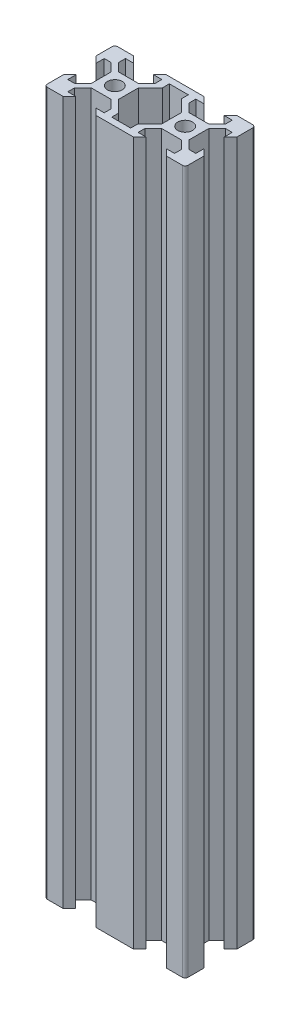
from build123d import *

# Parameters (mm, degrees)
SKETCH3_R               = 2.1
SALIENTE_EXTRUIR1_DEPTH = 200


with BuildPart() as part:
    # Sketch3 → Saliente-Extruir1 (new body)
    with BuildSketch(Plane(origin=(0, 0, 0), x_dir=(1, 0, 0), z_dir=(0, 1, 0))):
        with BuildLine():
            Line((-19.2, -10), (-14.728647189, -10))
            Line((-14.728647189, -10), (-12.928647189, -8.2))
            Line((-12.928647189, -8.2), (-15.179339828, -8.2))
            Line((-15.179339828, -8.2), (-15.179339828, -6.24))
            Line((-15.179339828, -6.24), (-12.84, -3.900660172))
            Line((-12.84, -3.900660172), (-7.16, -3.900660172))
            Line((-7.16, -3.900660172), (-4.820660172, -6.24))
            Line((-4.820660172, -6.24), (-4.820660172, -8.2))
            Line((-4.820660172, -8.2), (-7.104380066, -8.2))
            Line((-7.104380066, -8.2), (-5.304380066, -10))
            Line((-5.304380066, -10), (0, -10))
            Line((0, -10), (5.304380066, -10))
            Line((5.304380066, -10), (7.104380066, -8.2))
            Line((7.104380066, -8.2), (4.820660172, -8.2))
            Line((4.820660172, -8.2), (4.820660172, -6.24))
            Line((4.820660172, -6.24), (7.16, -3.900660172))
            Line((7.16, -3.900660172), (12.84, -3.900660172))
            Line((12.84, -3.900660172), (15.179339828, -6.24))
            Line((15.179339828, -6.24), (15.179339828, -8.2))
            Line((15.179339828, -8.2), (12.928647189, -8.2))
            Line((12.928647189, -8.2), (14.728647189, -10))
            Line((14.728647189, -10), (19.2, -10))
            ThreePointArc((19.2, -10), (19.765685425, -9.765685425), (20, -9.2))
            Line((20, -9.2), (20, -4.619288759))
            Line((20, -4.619288759), (18.2, -2.819288759))
            Line((18.2, -2.819288759), (18.2, -5.179339828))
            Line((18.2, -5.179339828), (16.24, -5.179339828))
            Line((16.24, -5.179339828), (13.900660172, -2.84))
            Line((13.900660172, -2.84), (13.900660172, 2.84))
            Line((13.900660172, 2.84), (16.24, 5.179339828))
            Line((16.24, 5.179339828), (18.2, 5.179339828))
            Line((18.2, 5.179339828), (18.2, 2.895619934))
            Line((18.2, 2.895619934), (20, 4.695619934))
            Line((20, 4.695619934), (20, 9.2))
            ThreePointArc((20, 9.2), (19.765685425, 9.765685425), (19.2, 10))
            Line((19.2, 10), (14.652316014, 10))
            Line((14.652316014, 10), (12.852316014, 8.2))
            Line((12.852316014, 8.2), (15.179339828, 8.2))
            Line((15.179339828, 8.2), (15.179339828, 6.24))
            Line((15.179339828, 6.24), (12.84, 3.900660172))
            Line((12.84, 3.900660172), (7.16, 3.900660172))
            Line((7.16, 3.900660172), (4.820660172, 6.24))
            Line((4.820660172, 6.24), (4.820660172, 8.2))
            Line((4.820660172, 8.2), (7.180711241, 8.2))
            Line((7.180711241, 8.2), (5.380711241, 10))
            Line((5.380711241, 10), (0, 10))
            Line((0, 10), (-5.380711241, 10))
            Line((-5.380711241, 10), (-7.180711241, 8.2))
            Line((-7.180711241, 8.2), (-4.820660172, 8.2))
            Line((-4.820660172, 8.2), (-4.820660172, 6.24))
            Line((-4.820660172, 6.24), (-7.16, 3.900660172))
            Line((-7.16, 3.900660172), (-12.84, 3.900660172))
            Line((-12.84, 3.900660172), (-15.179339828, 6.24))
            Line((-15.179339828, 6.24), (-15.179339828, 8.2))
            Line((-15.179339828, 8.2), (-12.852316014, 8.2))
            Line((-12.852316014, 8.2), (-14.652316014, 10))
            Line((-14.652316014, 10), (-19.2, 10))
            ThreePointArc((-19.2, 10), (-19.765685425, 9.765685425), (-20, 9.2))
            Line((-20, 9.2), (-20, 4.695619934))
            Line((-20, 4.695619934), (-18.2, 2.895619934))
            Line((-18.2, 2.895619934), (-18.2, 5.179339828))
            Line((-18.2, 5.179339828), (-16.24, 5.179339828))
            Line((-16.24, 5.179339828), (-13.900660172, 2.84))
            Line((-13.900660172, 2.84), (-13.900660172, -2.84))
            Line((-13.900660172, -2.84), (-16.24, -5.179339828))
            Line((-16.24, -5.179339828), (-18.2, -5.179339828))
            Line((-18.2, -5.179339828), (-18.2, -2.819288759))
            Line((-18.2, -2.819288759), (-20, -4.619288759))
            Line((-20, -4.619288759), (-20, -9.2))
            ThreePointArc((-20, -9.2), (-19.765685425, -9.765685425), (-19.2, -10))
        make_face()
        with Locations(Location((-10, 0, 0), (0, 0, 270))):
            Circle(SKETCH3_R, mode=Mode.SUBTRACT)
        with Locations(Location((10, 0, 0), (0, 0, 270))):
            Circle(SKETCH3_R, mode=Mode.SUBTRACT)
        Polygon((-2.699339828, -6.24), (-6.099339828, -2.84), (-6.099339828, 2.84), (-2.699339828, 6.24), (-2.699339828, 8.2), (2.699339828, 8.2), (2.699339828, 6.24), (6.099339828, 2.84), (6.099339828, -2.84), (2.699339828, -6.24), (2.699339828, -8.2), (-2.699339828, -8.2), align=None, mode=Mode.SUBTRACT)
    extrude(amount=SALIENTE_EXTRUIR1_DEPTH)


solid = part.part
